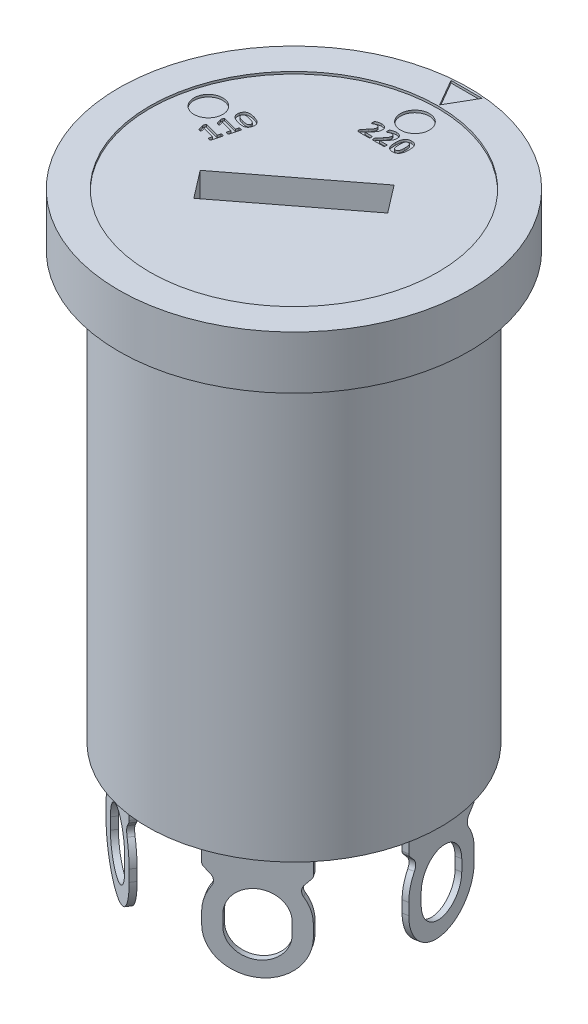
from build123d import *

# Parameters (mm, degrees)
SKETCH1_R                = 7.6
BOSS_EXTRUDE1_DEPTH      = 1.15
SKETCH2_R                = 6.35
BOSS_EXTRUDE2_DEPTH      = 18.5
BOSS_EXTRUDE3_DEPTH      = 5
CUT_EXTRUDE1_REACH       = 31.171
FILLET1_R                = 0.2
CIRPATTERN1_COUNT        = 4
CIRPATTERN1_ANGLE        = 200
FILLET1_OF_CIRPATTERN1_R = 0.2
SKETCH5_R                = 6.25
CUT_EXTRUDE2_DEPTH       = 0.1
CUT_EXTRUDE3_DEPTH       = 3
SKETCH7_R                = 0.625
CUT_EXTRUDE4_DEPTH       = 0.1


with BuildPart() as part:
    # Sketch1 → Boss-Extrude1 (new, symmetric)
    with BuildSketch(Plane(origin=(0, 0, 0), x_dir=(1, 0, 0), z_dir=(0, 1, 0))):
        with Locations(Location((0, 0, 0), (0, 0, 270))):
            Circle(SKETCH1_R)
    extrude(amount=BOSS_EXTRUDE1_DEPTH, both=True)

    # Sketch2 → Boss-Extrude2 (add)
    with BuildSketch(Plane.XZ.offset(1.15)):
        with Locations(Location((0, 0, 0), (0, 0, 270))):
            Circle(SKETCH2_R)
    extrude(amount=BOSS_EXTRUDE2_DEPTH)

    # Sketch3 → Boss-Extrude3 (add)
    with BuildSketch(Plane.XZ.offset(19.65)):
        Polygon((-5.137178524, -2.682819749), (-4.890976586, -2.639407705), (-5.498745208, 0.807419431), (-5.744947146, 0.764007386), align=None)
    boss_extrude3 = extrude(amount=BOSS_EXTRUDE3_DEPTH)

    # Sketch4 → Cut-Extrude1 (cut, up to next)
    with BuildSketch(Plane(origin=(-5.441062835, 0, -0.959406182), x_dir=(-0.1736481776669273, 0, 0.9848077530122086), z_dir=(-0.9848077530122086, 0, -0.1736481776669273)), mode=Mode.PRIVATE) as cut_extrude1_sk1:
        with BuildLine():
            Line((-1.084702388, -22.4), (-1.084702388, -22.9))
            ThreePointArc((-1.084702388, -22.9), (0, -23.984702388), (1.084702388, -22.9))
            Line((1.084702388, -22.9), (1.084702388, -22.4))
            ThreePointArc((1.084702388, -22.4), (0, -21.315297612), (-1.084702388, -22.4))
        make_face()
    cut_extrude1_tool1 = extrude(cut_extrude1_sk1.sketch, amount=-CUT_EXTRUDE1_REACH, mode=Mode.PRIVATE) & part.part
    # Sketch4 → Cut-Extrude1 (cut, up to next)
    with BuildSketch(Plane(origin=(-5.441062835, 0, -0.959406182), x_dir=(-0.1736481776669273, 0, 0.9848077530122086), z_dir=(-0.9848077530122086, 0, -0.1736481776669273)), mode=Mode.PRIVATE) as cut_extrude1_sk2:
        with BuildLine():
            Line((1.75, -20.65), (1.474258984, -20.960255312))
            ThreePointArc((1.474258984, -20.960255312), (1.381845573, -21.181807831), (1.445322291, -21.413316933))
            ThreePointArc((1.445322291, -21.413316933), (1.672096589, -21.883673557), (1.75, -22.4))
            Line((1.75, -22.4), (1.75, -20.65))
        make_face()
    cut_extrude1_tool2 = extrude(cut_extrude1_sk2.sketch, amount=-CUT_EXTRUDE1_REACH, mode=Mode.PRIVATE) & part.part
    # Sketch4 → Cut-Extrude1 (cut, up to next)
    with BuildSketch(Plane(origin=(-5.441062835, 0, -0.959406182), x_dir=(-0.1736481776669273, 0, 0.9848077530122086), z_dir=(-0.9848077530122086, 0, -0.1736481776669273)), mode=Mode.PRIVATE) as cut_extrude1_sk3:
        with BuildLine():
            Line((-1.75, -20.65), (-1.75, -22.4))
            ThreePointArc((-1.75, -22.4), (-1.672096589, -21.883673557), (-1.445322291, -21.413316933))
            ThreePointArc((-1.445322291, -21.413316933), (-1.381845573, -21.181807831), (-1.474258984, -20.960255312))
            Line((-1.474258984, -20.960255312), (-1.75, -20.65))
        make_face()
    cut_extrude1_tool3 = extrude(cut_extrude1_sk3.sketch, amount=-CUT_EXTRUDE1_REACH, mode=Mode.PRIVATE) & part.part
    # Sketch4 → Cut-Extrude1 (cut, up to next)
    with BuildSketch(Plane(origin=(-5.441062835, 0, -0.959406182), x_dir=(-0.1736481776669273, 0, 0.9848077530122086), z_dir=(-0.9848077530122086, 0, -0.1736481776669273)), mode=Mode.PRIVATE) as cut_extrude1_sk4:
        with BuildLine():
            Line((-1.75, -24.65), (1e-09, -24.65))
            ThreePointArc((1e-09, -24.65), (-1.237436867, -24.137436867), (-1.75, -22.9))
            Line((-1.75, -22.9), (-1.75, -24.65))
        make_face()
    cut_extrude1_tool4 = extrude(cut_extrude1_sk4.sketch, amount=-CUT_EXTRUDE1_REACH, mode=Mode.PRIVATE) & part.part
    # Sketch4 → Cut-Extrude1 (cut, up to next)
    with BuildSketch(Plane(origin=(-5.441062835, 0, -0.959406182), x_dir=(-0.1736481776669273, 0, 0.9848077530122086), z_dir=(-0.9848077530122086, 0, -0.1736481776669273)), mode=Mode.PRIVATE) as cut_extrude1_sk5:
        with BuildLine():
            Line((1.75, -24.65), (1.75, -22.9))
            ThreePointArc((1.75, -22.9), (1.237436867, -24.137436867), (1e-09, -24.65))
            Line((1e-09, -24.65), (1.75, -24.65))
        make_face()
    cut_extrude1_tool5 = extrude(cut_extrude1_sk5.sketch, amount=-CUT_EXTRUDE1_REACH, mode=Mode.PRIVATE) & part.part
    cut_extrude1_1 = cut_extrude1_tool1.solids().sort_by_distance((-5.441063, -22.65, -0.959406))[0]
    add(cut_extrude1_1, mode=Mode.SUBTRACT)
    cut_extrude1_2 = cut_extrude1_tool2.solids().sort_by_distance((-5.721703, -21.293717, 0.632181))[0]
    add(cut_extrude1_2, mode=Mode.SUBTRACT)
    cut_extrude1_3 = cut_extrude1_tool3.solids().sort_by_distance((-5.160423, -21.293717, -2.550993))[0]
    add(cut_extrude1_3, mode=Mode.SUBTRACT)
    cut_extrude1_4 = cut_extrude1_tool4.solids().sort_by_distance((-5.205057, -24.259106, -2.297864))[0]
    add(cut_extrude1_4, mode=Mode.SUBTRACT)
    cut_extrude1_5 = cut_extrude1_tool5.solids().sort_by_distance((-5.677069, -24.259106, 0.379052))[0]
    add(cut_extrude1_5, mode=Mode.SUBTRACT)
    cut_extrude1 = cut_extrude1_1 + cut_extrude1_2 + cut_extrude1_3 + cut_extrude1_4 + cut_extrude1_5  # Cut-Extrude1 as one shape, for the pattern or mirror that repeats it

    # Fillet1
    fillet1_edges = [part.edges().sort_by_distance(p)[0] for p in [
        (-5.014077555, -20.65, -2.661113727),
        (-5.621846177, -20.65, 0.785713408),
    ]]
    fillet(fillet1_edges, radius=FILLET1_R)

    # CirPattern1: Boss-Extrude3, Cut-Extrude1 ×4 about axis
    cirpattern1_axis = Axis((0, 0, 0), (0, 1, 0))
    add([boss_extrude3.rotate(cirpattern1_axis, i * CIRPATTERN1_ANGLE / (CIRPATTERN1_COUNT - 1)) for i in range(1, CIRPATTERN1_COUNT)])
    add([cut_extrude1.rotate(cirpattern1_axis, i * CIRPATTERN1_ANGLE / (CIRPATTERN1_COUNT - 1)) for i in range(1, CIRPATTERN1_COUNT)], mode=Mode.SUBTRACT)

    # Fillet1 of CirPattern1
    fillet1_of_cirpattern1_edges = [part.edges().sort_by_distance(p)[0] for p in [
        (-4.429452152, -20.65, 3.54999347),
        (-1.505244812, -20.65, 5.473274893),
        (1.505244812, -20.65, 5.473274893),
        (4.429452152, -20.65, 3.54999347),
        (5.621846177, -20.65, 0.785713408),
        (5.014077555, -20.65, -2.661113727),
    ]]
    fillet(fillet1_of_cirpattern1_edges, radius=FILLET1_OF_CIRPATTERN1_R)

    # Sketch5 → Cut-Extrude2 (cut)
    with BuildSketch(Plane(origin=(0, 1.15, 0), x_dir=(1, 0, 0), z_dir=(0, 1, 0))):
        with Locations(Location((0, 0, 0), (0, 0, 270))):
            Circle(SKETCH5_R)
        Polygon((0, 6.320577137), (0.675, 7.489711432), (-0.675, 7.489711432), align=None)
    extrude(amount=-CUT_EXTRUDE2_DEPTH, mode=Mode.SUBTRACT)

    # Sketch6 → Cut-Extrude3 (cut)
    with BuildSketch(Plane(origin=(0, 1.05, 0), x_dir=(1, 0, 0), z_dir=(0, 1, 0))):
        Polygon((-2.836631093, -1.231269282), (1.923488949, 2.421299292), (2.836631093, 1.231269282), (-1.923488949, -2.421299292), align=None)
    extrude(amount=-CUT_EXTRUDE3_DEPTH, mode=Mode.SUBTRACT)

    # Sketch7 → Cut-Extrude4 (cut)
    # profile 1 of 8: a face of its own
    with BuildSketch(Plane(origin=(0, 1.05, 0), x_dir=(1, 0, 0), z_dir=(0, 1, 0))):
        with Locations(Location((0, 5.25, 0), (0, 0, 270))):
            Circle(SKETCH7_R)
    # profile 2 of 8: a face of its own
    with BuildSketch(Plane(origin=(0, 1.05, 0), x_dir=(1, 0, 0), z_dir=(0, 1, 0))):
        with Locations(Location((-5.071110588, 1.358799987, 0), (0, 0, 270))):
            Circle(SKETCH7_R)
    # profile 3 of 8: a face of its own
    with BuildSketch(Plane(origin=(0, 1.05, 0), x_dir=(1, 0, 0), z_dir=(0, 1, 0))):
        with BuildLine():
            add(Edge.make_bspline(
                [(-3.673085561, 1.940530135), (-3.658145348, 1.936361866), (-3.62903577, 1.928240392), (-3.587140018, 1.913867484), (-3.547928097, 1.89851542), (-3.511575049, 1.881700826), (-3.478072823, 1.863870231), (-3.447977591, 1.844082858), (-3.421184433, 1.822698939), (-3.397658418, 1.799740336), (-3.377767174, 1.774961081), (-3.36157215, 1.748492487), (-3.348974447, 1.720329943), (-3.34042885, 1.690303427), (-3.335541318, 1.658374888), (-3.335406929, 1.624403585), (-3.339403169, 1.588393369), (-3.345353228, 1.564209779), (-3.348435974, 1.551680181)],
                knots=[0, 0, 0, 0, 1.288888502, 2.511276299, 3.67946271, 4.787240792, 5.83855392, 6.830771249, 7.776144556, 8.683694379, 9.557256889, 10.409980498, 11.255985797, 12.113159026, 12.99712284, 13.93195878, 14.92854091, 16, 16, 16, 16], degree=3))
            add(Edge.make_bspline(
                [(-3.348435974, 1.551680181), (-3.352064065, 1.539188901), (-3.359036652, 1.515182742), (-3.373299262, 1.481967022), (-3.390115576, 1.453021031), (-3.409383257, 1.428206666), (-3.431253127, 1.407500672), (-3.455339805, 1.390398241), (-3.481682399, 1.376783431), (-3.510246865, 1.366742302), (-3.540959073, 1.360109383), (-3.573819393, 1.356338579), (-3.608856279, 1.355442546), (-3.646016296, 1.357890469), (-3.685217038, 1.362659999), (-3.726422704, 1.369959365), (-3.769716625, 1.378974096), (-3.799022984, 1.386556399), (-3.814071027, 1.390449712)],
                knots=[0, 0, 0, 0, 1.10265549, 2.119120177, 3.057597963, 3.93557148, 4.77461656, 5.603166586, 6.433560418, 7.281780143, 8.163939511, 9.09343249, 10.083975126, 11.132740266, 12.249644105, 13.432427502, 14.68161916, 16, 16, 16, 16], degree=3))
            add(Edge.make_bspline(
                [(-3.814071027, 1.390449712), (-3.828888353, 1.394622667), (-3.857809707, 1.402767694), (-3.899525369, 1.417131822), (-3.938709652, 1.432530519), (-3.975319199, 1.449204161), (-4.008850075, 1.467515988), (-4.039112318, 1.487389119), (-4.065972279, 1.50882869), (-4.089498367, 1.53178647), (-4.109388554, 1.556566148), (-4.125587596, 1.583033856), (-4.138170368, 1.611199513), (-4.146770474, 1.641205652), (-4.151434556, 1.673170986), (-4.151298891, 1.706990564), (-4.147588964, 1.742820952), (-4.141752087, 1.766830127), (-4.138720613, 1.779299666)],
                knots=[0, 0, 0, 0, 1.280067043, 2.49851228, 3.667504, 4.780637386, 5.841954191, 6.841860431, 7.787885448, 8.696060907, 9.570225623, 10.423537073, 11.270125581, 12.127889718, 13.011725577, 13.947164967, 14.933828194, 16, 16, 16, 16], degree=3))
            add(Edge.make_bspline(
                [(-4.138720613, 1.779299666), (-4.13502552, 1.791791386), (-4.127928963, 1.815782177), (-4.113586713, 1.848983418), (-4.097132268, 1.878172674), (-4.077702101, 1.902951358), (-4.05591877, 1.923841367), (-4.031899459, 1.941084859), (-4.005618574, 1.95479833), (-3.977007787, 1.964740999), (-3.946295273, 1.971691424), (-3.913321809, 1.975154226), (-3.878295692, 1.975898339), (-3.841129703, 1.973292872), (-3.801977935, 1.968194002), (-3.76068497, 1.961341733), (-3.71746959, 1.951922273), (-3.688139492, 1.944394058), (-3.673085561, 1.940530135)],
                knots=[0, 0, 0, 0, 1.103382044, 2.119084338, 3.058725513, 3.936040511, 4.778012346, 5.608934786, 6.434132243, 7.281715765, 8.169368317, 9.09757777, 10.087256706, 11.135551956, 12.252248491, 13.433279306, 14.682608003, 16, 16, 16, 16], degree=3))
        make_face()
        with BuildLine():
            add(Edge.make_bspline(
                [(-3.707556781, 1.78112354), (-3.716367172, 1.783452413), (-3.733474209, 1.787974358), (-3.758434878, 1.794244062), (-3.781995581, 1.799464632), (-3.804033525, 1.804154135), (-3.824754464, 1.807659378), (-3.844091356, 1.811028027), (-3.862329119, 1.812836745), (-3.88411902, 1.814850337), (-3.908651563, 1.815597112), (-3.93490456, 1.813527346), (-3.957384849, 1.80896228), (-3.975917459, 1.800584592), (-3.991020091, 1.789392987), (-4.002808988, 1.775296999), (-4.011409801, 1.758422332), (-4.015133903, 1.746114382), (-4.017068212, 1.739721599)],
                knots=[0, 0, 0, 0, 1.253449212, 2.433807992, 3.539439553, 4.57262314, 5.532225414, 6.429933913, 7.271186828, 8.051733231, 9.440243207, 10.640225063, 11.668762209, 12.578117937, 13.414326999, 14.233385131, 15.082415333, 16, 16, 16, 16], degree=3))
            add(Edge.make_bspline(
                [(-4.017068212, 1.739721599), (-4.018404092, 1.734095858), (-4.020980447, 1.723246157), (-4.021794628, 1.706995335), (-4.02053717, 1.691597989), (-4.01616237, 1.677188935), (-4.009462827, 1.663554763), (-4.000128582, 1.650827817), (-3.988765504, 1.638419455), (-3.974672369, 1.627020605), (-3.95833926, 1.615993361), (-3.939509689, 1.60582433), (-3.91856731, 1.595654744), (-3.895205433, 1.58607251), (-3.869440215, 1.576908954), (-3.841562776, 1.567554024), (-3.811421877, 1.558493147), (-3.790553585, 1.552676331), (-3.779782194, 1.549673919)],
                knots=[0, 0, 0, 0, 0.815250163, 1.572276623, 2.288444131, 2.986881971, 3.685953218, 4.424782941, 5.208806639, 6.056657412, 6.978535701, 7.989600004, 9.076709549, 10.266580688, 11.554373423, 12.939529382, 14.420305599, 16, 16, 16, 16], degree=3))
            add(Edge.make_bspline(
                [(-3.779782194, 1.549673919), (-3.76672587, 1.546271163), (-3.741710461, 1.539751613), (-3.705720592, 1.531361061), (-3.673013368, 1.524691885), (-3.643500995, 1.519900578), (-3.616853915, 1.516680765), (-3.592858574, 1.515157952), (-3.571331615, 1.515236159), (-3.552268604, 1.516977086), (-3.535370946, 1.520332502), (-3.520712698, 1.525633862), (-3.508007074, 1.532392328), (-3.497348135, 1.5409295), (-3.488703373, 1.551338063), (-3.481183987, 1.562989109), (-3.475135098, 1.576289164), (-3.472285577, 1.585808257), (-3.470817925, 1.590711086)],
                knots=[0, 0, 0, 0, 1.858093567, 3.56003503, 5.088754229, 6.45421991, 7.676573755, 8.783795317, 9.763434588, 10.638209312, 11.416553333, 12.129018664, 12.777185194, 13.390451812, 13.996184933, 14.63256365, 15.295698887, 16, 16, 16, 16], degree=3))
            add(Edge.make_bspline(
                [(-3.470817925, 1.590711086), (-3.469146185, 1.598087799), (-3.465950071, 1.612190956), (-3.466632992, 1.633375654), (-3.471359248, 1.653117435), (-3.480915769, 1.671340846), (-3.494507099, 1.688446326), (-3.512865608, 1.703844069), (-3.535163931, 1.718429886), (-3.561614711, 1.732107031), (-3.591993849, 1.745545098), (-3.626821097, 1.757671262), (-3.665736918, 1.769681903), (-3.69318551, 1.777191656), (-3.707556781, 1.78112354)],
                knots=[0, 0, 0, 0, 0.799174179, 1.527900087, 2.225239573, 2.934486112, 3.691601609, 4.527901275, 5.463018283, 6.512691251, 7.681737495, 8.982679637, 10.420220384, 12, 12, 12, 12], degree=3))
        make_face(mode=Mode.SUBTRACT)
    # profile 4 of 8: a face of its own
    with BuildSketch(Plane(origin=(0, 1.05, 0), x_dir=(1, 0, 0), z_dir=(0, 1, 0))):
        with BuildLine():
            add(Edge.make_bspline(
                [(-3.518064113, 1.210057821), (-3.512925018, 1.208631321), (-3.503517025, 1.20601987), (-3.491040011, 1.201143143), (-3.48094146, 1.196680225), (-3.473694748, 1.191413636), (-3.468438595, 1.186353541), (-3.465608599, 1.181017296), (-3.464251117, 1.175682974), (-3.464859542, 1.172244345), (-3.465171765, 1.170479754)],
                knots=[0, 0, 0, 0, 1.771150707, 3.242394248, 4.453591281, 5.423837813, 6.20991664, 6.851853358, 7.41080901, 8, 8, 8, 8], degree=3))
            Line((-3.465171765, 1.170479754), (-3.578434345, 0.747340967))
            add(Edge.make_bspline(
                [(-3.578434345, 0.747340967), (-3.579018029, 0.745836899), (-3.580227818, 0.742719446), (-3.583872723, 0.738708316), (-3.589351047, 0.736093794), (-3.596213872, 0.733986602), (-3.605129673, 0.733481009), (-3.61608362, 0.73403912), (-3.62929967, 0.73642766), (-3.63875903, 0.738769759), (-3.643911425, 0.740045471)],
                knots=[0, 0, 0, 0, 0.537906039, 1.114907901, 1.762103588, 2.548575406, 3.509645445, 4.733651234, 6.220860693, 8, 8, 8, 8], degree=3))
            add(Edge.make_bspline(
                [(-3.643911425, 0.740045471), (-3.649153171, 0.741511848), (-3.658745305, 0.744195245), (-3.671662623, 0.748594198), (-3.681712504, 0.753502), (-3.689697168, 0.758138957), (-3.694730409, 0.763683431), (-3.698595548, 0.768685349), (-3.699675236, 0.774331278), (-3.699096928, 0.777868669), (-3.698810035, 0.779623538)],
                knots=[0, 0, 0, 0, 1.767848226, 3.235073704, 4.418112217, 5.403692162, 6.199406899, 6.839944907, 7.42450682, 8, 8, 8, 8], degree=3))
            Line((-3.698810035, 0.779623538), (-3.660691067, 0.922432879))
            Line((-3.660691067, 0.922432879), (-4.159703015, 1.056122849))
            Line((-4.159703015, 1.056122849), (-4.124684633, 0.91459022))
            add(Edge.make_bspline(
                [(-4.124684633, 0.91459022), (-4.123885088, 0.909980743), (-4.122481657, 0.901889783), (-4.122224105, 0.891042203), (-4.124030064, 0.882450065), (-4.12987786, 0.876672398), (-4.138804446, 0.87465652), (-4.147731034, 0.875002977), (-4.156486324, 0.876564718), (-4.164741669, 0.877907612), (-4.174196567, 0.880209159), (-4.180923255, 0.881935106), (-4.184507703, 0.882854811)],
                knots=[0, 0, 0, 0, 1.4683962, 2.577457833, 3.412708581, 4.142849099, 5.020160429, 6.205863269, 6.941491768, 7.815462538, 8.835926519, 10, 10, 10, 10], degree=3))
            add(Edge.make_bspline(
                [(-4.184507703, 0.882854811), (-4.18883067, 0.884047791), (-4.196656791, 0.886207513), (-4.207236696, 0.889458446), (-4.215766403, 0.892704441), (-4.222580322, 0.896532534), (-4.22772993, 0.901184566), (-4.231854164, 0.906409783), (-4.234982924, 0.912791337), (-4.236662563, 0.917489069), (-4.237582438, 0.920061842)],
                knots=[0, 0, 0, 0, 1.563236685, 2.830018684, 3.85715216, 4.740405492, 5.535906752, 6.260807096, 7.047508607, 8, 8, 8, 8], degree=3))
            Line((-4.237582438, 0.920061842), (-4.300141319, 1.113392495))
            add(Edge.make_bspline(
                [(-4.300141319, 1.113392495), (-4.300525058, 1.114723404), (-4.301318242, 1.117474375), (-4.302218682, 1.12211569), (-4.301714849, 1.127691112), (-4.301329011, 1.134654347), (-4.299711782, 1.143237377), (-4.297182083, 1.153960499), (-4.293899044, 1.167493177), (-4.291117796, 1.177480659), (-4.28956285, 1.183064485)],
                knots=[0, 0, 0, 0, 0.46664555, 0.964550346, 1.578804146, 2.338448065, 3.314078128, 4.510464578, 6.049061819, 8, 8, 8, 8], degree=3))
            add(Edge.make_bspline(
                [(-4.28956285, 1.183064485), (-4.287732094, 1.189890265), (-4.284481316, 1.202010443), (-4.279457779, 1.217990032), (-4.275228389, 1.2301249), (-4.27103755, 1.238691652), (-4.267121153, 1.244609833), (-4.26240908, 1.247541673), (-4.257499715, 1.248280931), (-4.254353042, 1.247611924), (-4.252720593, 1.247264853)],
                knots=[0, 0, 0, 0, 2.098582548, 3.72634283, 4.977594343, 5.90632889, 6.563663806, 7.049900541, 7.507102178, 8, 8, 8, 8], degree=3))
            Line((-4.252720593, 1.247264853), (-3.619106737, 1.077644563))
            Line((-3.619106737, 1.077644563), (-3.585547454, 1.202762325))
            add(Edge.make_bspline(
                [(-3.585547454, 1.202762325), (-3.584936083, 1.204474233), (-3.583724651, 1.207866381), (-3.579587837, 1.211938343), (-3.574030523, 1.215058199), (-3.566608782, 1.216705672), (-3.557517097, 1.217490526), (-3.546376016, 1.216280176), (-3.532983569, 1.213865225), (-3.523338825, 1.211403913), (-3.518064113, 1.210057821)],
                knots=[0, 0, 0, 0, 0.581756919, 1.152752086, 1.831682654, 2.624413837, 3.592408048, 4.777872241, 6.237818275, 8, 8, 8, 8], degree=3))
        make_face()
    # profile 5 of 8: a face of its own
    with BuildSketch(Plane(origin=(0, 1.05, 0), x_dir=(1, 0, 0), z_dir=(0, 1, 0))):
        with BuildLine():
            add(Edge.make_bspline(
                [(-3.684226892, 0.58992989), (-3.679087797, 0.58850339), (-3.669679804, 0.585891938), (-3.65720279, 0.581015211), (-3.647104238, 0.576552293), (-3.639857526, 0.571285704), (-3.634601374, 0.56622561), (-3.631771378, 0.560889365), (-3.630413896, 0.555555042), (-3.63102232, 0.552116413), (-3.631334544, 0.550351822)],
                knots=[0, 0, 0, 0, 1.771150707, 3.242394248, 4.453591281, 5.423837813, 6.20991664, 6.851853358, 7.41080901, 8, 8, 8, 8], degree=3))
            Line((-3.631334544, 0.550351822), (-3.744597124, 0.127213035))
            add(Edge.make_bspline(
                [(-3.744597124, 0.127213035), (-3.745180807, 0.125708968), (-3.746390596, 0.122591514), (-3.750035502, 0.118580384), (-3.755513825, 0.115965863), (-3.762376651, 0.11385867), (-3.771292452, 0.113353077), (-3.782246399, 0.113911188), (-3.795462448, 0.116299729), (-3.804921808, 0.118641827), (-3.810074203, 0.119917539)],
                knots=[0, 0, 0, 0, 0.537906039, 1.114907901, 1.762103588, 2.548575406, 3.509645445, 4.733651234, 6.220860693, 8, 8, 8, 8], degree=3))
            add(Edge.make_bspline(
                [(-3.810074203, 0.119917539), (-3.81531595, 0.121383916), (-3.824908083, 0.124067313), (-3.837825401, 0.128466266), (-3.847875283, 0.133374069), (-3.855859947, 0.138011025), (-3.860893187, 0.143555499), (-3.864758326, 0.148557417), (-3.865838014, 0.154203346), (-3.865259707, 0.157740738), (-3.864972813, 0.159495607)],
                knots=[0, 0, 0, 0, 1.767848226, 3.235073704, 4.418112217, 5.403692162, 6.199406899, 6.839944907, 7.42450682, 8, 8, 8, 8], degree=3))
            Line((-3.864972813, 0.159495607), (-3.826853845, 0.302304947))
            Line((-3.826853845, 0.302304947), (-4.325865794, 0.435994917))
            Line((-4.325865794, 0.435994917), (-4.290847411, 0.294462289))
            add(Edge.make_bspline(
                [(-4.290847411, 0.294462289), (-4.290047866, 0.289852811), (-4.288644435, 0.281761852), (-4.288386883, 0.270914271), (-4.290192843, 0.262322133), (-4.296040639, 0.256544466), (-4.304967225, 0.254528589), (-4.313893812, 0.254875045), (-4.322649103, 0.256436786), (-4.330904447, 0.25777968), (-4.340359345, 0.260081227), (-4.347086034, 0.261807175), (-4.350670481, 0.26272688)],
                knots=[0, 0, 0, 0, 1.4683962, 2.577457833, 3.412708581, 4.142849099, 5.020160429, 6.205863269, 6.941491768, 7.815462538, 8.835926519, 10, 10, 10, 10], degree=3))
            add(Edge.make_bspline(
                [(-4.350670481, 0.26272688), (-4.354993449, 0.26391986), (-4.36281957, 0.266079581), (-4.373399475, 0.269330515), (-4.381929181, 0.272576509), (-4.3887431, 0.276404602), (-4.393892709, 0.281056635), (-4.398016942, 0.286281852), (-4.401145702, 0.292663406), (-4.402825341, 0.297361137), (-4.403745217, 0.299933911)],
                knots=[0, 0, 0, 0, 1.563236685, 2.830018684, 3.85715216, 4.740405492, 5.535906752, 6.260807096, 7.047508607, 8, 8, 8, 8], degree=3))
            Line((-4.403745217, 0.299933911), (-4.466304098, 0.493264563))
            add(Edge.make_bspline(
                [(-4.466304098, 0.493264563), (-4.466687837, 0.494595472), (-4.467481021, 0.497346443), (-4.468381461, 0.501987758), (-4.467877628, 0.50756318), (-4.467491789, 0.514526415), (-4.465874561, 0.523109446), (-4.463344861, 0.533832568), (-4.460061822, 0.547365245), (-4.457280575, 0.557352727), (-4.455725628, 0.562936553)],
                knots=[0, 0, 0, 0, 0.46664555, 0.964550346, 1.578804146, 2.338448065, 3.314078128, 4.510464578, 6.049061819, 8, 8, 8, 8], degree=3))
            add(Edge.make_bspline(
                [(-4.455725628, 0.562936553), (-4.453894872, 0.569762333), (-4.450644095, 0.581882511), (-4.445620558, 0.597862101), (-4.441391167, 0.609996968), (-4.437200328, 0.618563721), (-4.433283932, 0.624481902), (-4.428571859, 0.627413741), (-4.423662494, 0.628153), (-4.42051582, 0.627483992), (-4.418883372, 0.627136921)],
                knots=[0, 0, 0, 0, 2.098582548, 3.72634283, 4.977594343, 5.90632889, 6.563663806, 7.049900541, 7.507102178, 8, 8, 8, 8], degree=3))
            Line((-4.418883372, 0.627136921), (-3.785269516, 0.457516631))
            Line((-3.785269516, 0.457516631), (-3.751710233, 0.582634393))
            add(Edge.make_bspline(
                [(-3.751710233, 0.582634393), (-3.751098862, 0.584346302), (-3.74988743, 0.58773845), (-3.745750616, 0.591810411), (-3.740193301, 0.594930267), (-3.73277156, 0.596577741), (-3.723679876, 0.597362594), (-3.712538794, 0.596152245), (-3.699146348, 0.593737293), (-3.689501603, 0.591275981), (-3.684226892, 0.58992989)],
                knots=[0, 0, 0, 0, 0.581756919, 1.152752086, 1.831682654, 2.624413837, 3.592408048, 4.777872241, 6.237818275, 8, 8, 8, 8], degree=3))
        make_face()
    # profile 6 of 8: a face of its own
    with BuildSketch(Plane(origin=(0, 1.05, 0), x_dir=(1, 0, 0), z_dir=(0, 1, 0))):
        with BuildLine():
            add(Edge.make_bspline(
                [(-0.367693015, 3.714565142), (-0.367720313, 3.709148665), (-0.36777071, 3.699149058), (-0.369172904, 3.685408241), (-0.370730441, 3.673966595), (-0.373508673, 3.664910665), (-0.376745599, 3.657760608), (-0.381572878, 3.653076958), (-0.387179952, 3.650600006), (-0.391077588, 3.650201261), (-0.393044864, 3.65)],
                knots=[0, 0, 0, 0, 1.700477232, 3.139328327, 4.338937117, 5.31779253, 6.112293145, 6.774269824, 7.381330181, 8, 8, 8, 8], degree=3))
            Line((-0.393044864, 3.65), (-0.853208295, 3.65))
            add(Edge.make_bspline(
                [(-0.853208295, 3.65), (-0.857468038, 3.650088655), (-0.865425958, 3.650254278), (-0.87654221, 3.651865076), (-0.885959822, 3.655508519), (-0.893615037, 3.661692731), (-0.898971277, 3.670929361), (-0.90251394, 3.683080677), (-0.90425773, 3.69864812), (-0.904504773, 3.710184477), (-0.904641544, 3.716571404)],
                knots=[0, 0, 0, 0, 1.025949817, 1.916647791, 2.69162005, 3.43032923, 4.23901448, 5.220859075, 6.461371377, 8, 8, 8, 8], degree=3))
            add(Edge.make_bspline(
                [(-0.904641544, 3.716571404), (-0.90451322, 3.722773716), (-0.904276392, 3.734220455), (-0.903171496, 3.750228441), (-0.900668367, 3.764035213), (-0.896573656, 3.776342211), (-0.890674605, 3.787469145), (-0.88380878, 3.79866123), (-0.874721253, 3.809899218), (-0.867843319, 3.817411756), (-0.86415154, 3.821444164)],
                knots=[0, 0, 0, 0, 1.279770231, 2.361892714, 3.306414937, 4.167028953, 5.025172171, 5.898575693, 6.872045744, 8, 8, 8, 8], degree=3))
            Line((-0.86415154, 3.821444164), (-0.72900247, 3.96662454))
            add(Edge.make_bspline(
                [(-0.72900247, 3.96662454), (-0.722580217, 3.973642133), (-0.710161004, 3.987212599), (-0.692818508, 4.007412717), (-0.677498174, 4.026709373), (-0.664105263, 4.045060988), (-0.652311406, 4.062528719), (-0.642023722, 4.079170173), (-0.632919408, 4.094997347), (-0.623012628, 4.114563674), (-0.613438118, 4.137583161), (-0.605930475, 4.164001522), (-0.601996773, 4.188526861), (-0.601424584, 4.204324234), (-0.601148897, 4.211935604)],
                knots=[0, 0, 0, 0, 1.20947157, 2.338849612, 3.384319872, 4.341377303, 5.226828348, 6.063423144, 6.828539773, 7.547598628, 8.851019864, 9.991402106, 11.032232556, 12, 12, 12, 12], degree=3))
            add(Edge.make_bspline(
                [(-0.601148897, 4.211935604), (-0.601471974, 4.218046495), (-0.60211198, 4.230151996), (-0.606974784, 4.247562721), (-0.614810107, 4.263585418), (-0.626178312, 4.277376326), (-0.640480073, 4.289044416), (-0.658245494, 4.297355324), (-0.679137946, 4.302808839), (-0.694188461, 4.303375272), (-0.702191521, 4.303676471)],
                knots=[0, 0, 0, 0, 0.952592796, 1.887059298, 2.799298945, 3.716508085, 4.654435942, 5.655858967, 6.753510967, 8, 8, 8, 8], degree=3))
            add(Edge.make_bspline(
                [(-0.702191521, 4.303676471), (-0.708031206, 4.303573399), (-0.719370218, 4.303373263), (-0.73591358, 4.301767117), (-0.751378967, 4.298812715), (-0.770213941, 4.293792789), (-0.791398684, 4.285950652), (-0.813937165, 4.275398677), (-0.832986223, 4.264743982), (-0.846716515, 4.25646049), (-0.855853747, 4.250442991), (-0.861813498, 4.247808007), (-0.86686657, 4.245677222), (-0.870154523, 4.245425442), (-0.871629423, 4.2453125)],
                knots=[0, 0, 0, 0, 1.155956231, 2.244538859, 3.28550842, 4.269318886, 6.100628768, 7.748195433, 9.191883973, 10.417953324, 10.925724687, 11.351067817, 11.708904068, 12, 12, 12, 12], degree=3))
            add(Edge.make_bspline(
                [(-0.871629423, 4.2453125), (-0.873378938, 4.245468987), (-0.876902662, 4.245784169), (-0.881622821, 4.249161787), (-0.885315283, 4.254610275), (-0.887915209, 4.262550799), (-0.889963408, 4.273087286), (-0.891797997, 4.286602082), (-0.892796436, 4.303297052), (-0.892908002, 4.3154696), (-0.89296875, 4.322097599)],
                knots=[0, 0, 0, 0, 0.485692822, 0.97824142, 1.565816375, 2.311318477, 3.305989244, 4.581102635, 6.138397226, 8, 8, 8, 8], degree=3))
            add(Edge.make_bspline(
                [(-0.89296875, 4.322097599), (-0.89296622, 4.326598498), (-0.892961635, 4.334756543), (-0.892161193, 4.346010271), (-0.891171956, 4.35541287), (-0.889531288, 4.363421608), (-0.887332115, 4.370271028), (-0.884451692, 4.37664223), (-0.879828864, 4.382995018), (-0.874598169, 4.388734116), (-0.868522516, 4.393823878), (-0.862156325, 4.398291291), (-0.85422119, 4.403294471), (-0.840706404, 4.410533686), (-0.820718106, 4.42025533), (-0.792934879, 4.430764594), (-0.761346603, 4.440494345), (-0.726630687, 4.448741199), (-0.689484969, 4.454440085), (-0.663911457, 4.455092096), (-0.650940659, 4.455422794)],
                knots=[0, 0, 0, 0, 0.788292368, 1.428808632, 1.975788089, 2.443732868, 2.858052408, 3.234493626, 3.66294862, 4.228288178, 4.591069522, 5.049213324, 5.590039132, 6.233559628, 7.734267659, 9.480939635, 11.431700141, 13.521863135, 15.728704436, 18, 18, 18, 18], degree=3))
            add(Edge.make_bspline(
                [(-0.650940659, 4.455422794), (-0.640840598, 4.455275256), (-0.621263943, 4.454989288), (-0.592848155, 4.452001203), (-0.566391079, 4.447228485), (-0.54196441, 4.440187078), (-0.519508462, 4.431648818), (-0.498902697, 4.421656519), (-0.480393856, 4.409932059), (-0.463836353, 4.396699641), (-0.449251295, 4.382160874), (-0.436594659, 4.366210516), (-0.426094867, 4.348893518), (-0.417446248, 4.330367486), (-0.410958659, 4.310806509), (-0.406248656, 4.290536501), (-0.403156945, 4.269543037), (-0.402861589, 4.255294083), (-0.402711397, 4.248048311)],
                knots=[0, 0, 0, 0, 1.324900052, 2.568015312, 3.744666331, 4.8481595, 5.898614886, 6.894039723, 7.847934722, 8.767415271, 9.669989851, 10.544631889, 11.43259769, 12.321315746, 13.221949113, 14.131442766, 15.049815173, 16, 16, 16, 16], degree=3))
            add(Edge.make_bspline(
                [(-0.402711397, 4.248048311), (-0.40306839, 4.235202567), (-0.403780544, 4.20957703), (-0.408438679, 4.177655116), (-0.414319969, 4.152033828), (-0.421141295, 4.132250616), (-0.429433564, 4.111558356), (-0.440207646, 4.090224044), (-0.452875849, 4.067794182), (-0.467869354, 4.04430813), (-0.485247745, 4.019687714), (-0.505147634, 3.993823107), (-0.527781892, 3.966223449), (-0.553695565, 3.936723387), (-0.583134161, 3.905216282), (-0.604086544, 3.883720001), (-0.61501034, 3.872512638)],
                knots=[0, 0, 0, 0, 1.214695824, 2.423155294, 3.043825433, 3.698462194, 4.400034292, 5.150962269, 5.956941602, 6.835925221, 7.785176393, 8.806499493, 9.921972916, 11.160753287, 12.51972206, 14, 14, 14, 14], degree=3))
            Line((-0.61501034, 3.872512638), (-0.706204044, 3.778400735))
            Line((-0.706204044, 3.778400735), (-0.395051126, 3.778400735))
            add(Edge.make_bspline(
                [(-0.395051126, 3.778400735), (-0.393067892, 3.778232552), (-0.389085417, 3.777894828), (-0.38356515, 3.774793893), (-0.378499283, 3.770178577), (-0.374541585, 3.763211376), (-0.37121184, 3.754320005), (-0.369303557, 3.743016541), (-0.367740709, 3.729565031), (-0.36770966, 3.719800258), (-0.367693015, 3.714565142)],
                knots=[0, 0, 0, 0, 0.620001289, 1.24500623, 1.94939785, 2.757032326, 3.738367869, 4.928457297, 6.353276405, 8, 8, 8, 8], degree=3))
        make_face()
    # profile 7 of 8: a face of its own
    with BuildSketch(Plane(origin=(0, 1.05, 0), x_dir=(1, 0, 0), z_dir=(0, 1, 0))):
        with BuildLine():
            add(Edge.make_bspline(
                [(0.274310662, 3.714565142), (0.274283363, 3.709148665), (0.274232967, 3.699149058), (0.272830773, 3.685408241), (0.271273235, 3.673966595), (0.268495003, 3.664910665), (0.265258077, 3.657760608), (0.260430798, 3.653076958), (0.254823724, 3.650600006), (0.250926088, 3.650201261), (0.248958812, 3.65)],
                knots=[0, 0, 0, 0, 1.700477232, 3.139328327, 4.338937117, 5.31779253, 6.112293145, 6.774269824, 7.381330181, 8, 8, 8, 8], degree=3))
            Line((0.248958812, 3.65), (-0.211204619, 3.65))
            add(Edge.make_bspline(
                [(-0.211204619, 3.65), (-0.215464361, 3.650088655), (-0.223422281, 3.650254278), (-0.234538533, 3.651865076), (-0.243956146, 3.655508519), (-0.251611361, 3.661692731), (-0.256967601, 3.670929361), (-0.260510263, 3.683080677), (-0.262254054, 3.69864812), (-0.262501096, 3.710184477), (-0.262637868, 3.716571404)],
                knots=[0, 0, 0, 0, 1.025949817, 1.916647791, 2.69162005, 3.43032923, 4.23901448, 5.220859075, 6.461371377, 8, 8, 8, 8], degree=3))
            add(Edge.make_bspline(
                [(-0.262637868, 3.716571404), (-0.262509544, 3.722773716), (-0.262272715, 3.734220455), (-0.261167819, 3.750228441), (-0.258664691, 3.764035213), (-0.25456998, 3.776342211), (-0.248670928, 3.787469145), (-0.241805103, 3.79866123), (-0.232717577, 3.809899218), (-0.225839642, 3.817411756), (-0.222147863, 3.821444164)],
                knots=[0, 0, 0, 0, 1.279770231, 2.361892714, 3.306414937, 4.167028953, 5.025172171, 5.898575693, 6.872045744, 8, 8, 8, 8], degree=3))
            Line((-0.222147863, 3.821444164), (-0.086998794, 3.96662454))
            add(Edge.make_bspline(
                [(-0.086998794, 3.96662454), (-0.08057654, 3.973642133), (-0.068157327, 3.987212599), (-0.050814831, 4.007412717), (-0.035494497, 4.026709373), (-0.022101586, 4.045060988), (-0.010307729, 4.062528719), (-2.0045e-05, 4.079170173), (0.009084268, 4.094997347), (0.018991048, 4.114563674), (0.028565558, 4.137583161), (0.036073202, 4.164001522), (0.040006904, 4.188526861), (0.040579092, 4.204324234), (0.040854779, 4.211935604)],
                knots=[0, 0, 0, 0, 1.20947157, 2.338849612, 3.384319872, 4.341377303, 5.226828348, 6.063423144, 6.828539773, 7.547598628, 8.851019864, 9.991402106, 11.032232556, 12, 12, 12, 12], degree=3))
            add(Edge.make_bspline(
                [(0.040854779, 4.211935604), (0.040531703, 4.218046495), (0.039891696, 4.230151996), (0.035028893, 4.247562721), (0.02719357, 4.263585418), (0.015825364, 4.277376326), (0.001523603, 4.289044416), (-0.016241817, 4.297355324), (-0.03713427, 4.302808839), (-0.052184784, 4.303375272), (-0.060187845, 4.303676471)],
                knots=[0, 0, 0, 0, 0.952592796, 1.887059298, 2.799298945, 3.716508085, 4.654435942, 5.655858967, 6.753510967, 8, 8, 8, 8], degree=3))
            add(Edge.make_bspline(
                [(-0.060187845, 4.303676471), (-0.06602753, 4.303573399), (-0.077366541, 4.303373263), (-0.093909903, 4.301767117), (-0.109375291, 4.298812715), (-0.128210265, 4.293792789), (-0.149395008, 4.285950652), (-0.171933488, 4.275398677), (-0.190982547, 4.264743982), (-0.204712839, 4.25646049), (-0.21385007, 4.250442991), (-0.219809822, 4.247808007), (-0.224862893, 4.245677222), (-0.228150847, 4.245425442), (-0.229625747, 4.2453125)],
                knots=[0, 0, 0, 0, 1.155956231, 2.244538859, 3.28550842, 4.269318886, 6.100628768, 7.748195433, 9.191883973, 10.417953324, 10.925724687, 11.351067817, 11.708904068, 12, 12, 12, 12], degree=3))
            add(Edge.make_bspline(
                [(-0.229625747, 4.2453125), (-0.231375261, 4.245468987), (-0.234898985, 4.245784169), (-0.239619145, 4.249161787), (-0.243311606, 4.254610275), (-0.245911533, 4.262550799), (-0.247959731, 4.273087286), (-0.24979432, 4.286602082), (-0.25079276, 4.303297052), (-0.250904326, 4.3154696), (-0.250965074, 4.322097599)],
                knots=[0, 0, 0, 0, 0.485692822, 0.97824142, 1.565816375, 2.311318477, 3.305989244, 4.581102635, 6.138397226, 8, 8, 8, 8], degree=3))
            add(Edge.make_bspline(
                [(-0.250965074, 4.322097599), (-0.250962544, 4.326598498), (-0.250957958, 4.334756543), (-0.250157516, 4.346010271), (-0.24916828, 4.35541287), (-0.247527611, 4.363421608), (-0.245328439, 4.370271028), (-0.242448015, 4.37664223), (-0.237825187, 4.382995018), (-0.232594493, 4.388734116), (-0.22651884, 4.393823878), (-0.220152648, 4.398291291), (-0.212217514, 4.403294471), (-0.198702728, 4.410533686), (-0.178714429, 4.42025533), (-0.150931203, 4.430764594), (-0.119342927, 4.440494345), (-0.08462701, 4.448741199), (-0.047481293, 4.454440085), (-0.02190778, 4.455092096), (-0.008936983, 4.455422794)],
                knots=[0, 0, 0, 0, 0.788292368, 1.428808632, 1.975788089, 2.443732868, 2.858052408, 3.234493626, 3.66294862, 4.228288178, 4.591069522, 5.049213324, 5.590039132, 6.233559628, 7.734267659, 9.480939635, 11.431700141, 13.521863135, 15.728704436, 18, 18, 18, 18], degree=3))
            add(Edge.make_bspline(
                [(-0.008936983, 4.455422794), (0.001163078, 4.455275256), (0.020739733, 4.454989288), (0.049155522, 4.452001203), (0.075612597, 4.447228485), (0.100039267, 4.440187078), (0.122495215, 4.431648818), (0.14310098, 4.421656519), (0.16160982, 4.409932059), (0.178167323, 4.396699641), (0.192752381, 4.382160874), (0.205409018, 4.366210516), (0.21590881, 4.348893518), (0.224557428, 4.330367486), (0.231045017, 4.310806509), (0.23575502, 4.290536501), (0.238846732, 4.269543037), (0.239142087, 4.255294083), (0.239292279, 4.248048311)],
                knots=[0, 0, 0, 0, 1.324900052, 2.568015312, 3.744666331, 4.8481595, 5.898614886, 6.894039723, 7.847934722, 8.767415271, 9.669989851, 10.544631889, 11.43259769, 12.321315746, 13.221949113, 14.131442766, 15.049815173, 16, 16, 16, 16], degree=3))
            add(Edge.make_bspline(
                [(0.239292279, 4.248048311), (0.238935286, 4.235202567), (0.238223133, 4.20957703), (0.233564997, 4.177655116), (0.227683708, 4.152033828), (0.220862382, 4.132250616), (0.212570112, 4.111558356), (0.20179603, 4.090224044), (0.189127828, 4.067794182), (0.174134323, 4.04430813), (0.156755931, 4.019687714), (0.136856042, 3.993823107), (0.114221785, 3.966223449), (0.088308111, 3.936723387), (0.058869516, 3.905216282), (0.037917132, 3.883720001), (0.026993336, 3.872512638)],
                knots=[0, 0, 0, 0, 1.214695824, 2.423155294, 3.043825433, 3.698462194, 4.400034292, 5.150962269, 5.956941602, 6.835925221, 7.785176393, 8.806499493, 9.921972916, 11.160753287, 12.51972206, 14, 14, 14, 14], degree=3))
            Line((0.026993336, 3.872512638), (-0.064200368, 3.778400735))
            Line((-0.064200368, 3.778400735), (0.246952551, 3.778400735))
            add(Edge.make_bspline(
                [(0.246952551, 3.778400735), (0.248935785, 3.778232552), (0.252918259, 3.777894828), (0.258438526, 3.774793893), (0.263504394, 3.770178577), (0.267462092, 3.763211376), (0.270791836, 3.754320005), (0.27270012, 3.743016541), (0.274262968, 3.729565031), (0.274294016, 3.719800258), (0.274310662, 3.714565142)],
                knots=[0, 0, 0, 0, 0.620001289, 1.24500623, 1.94939785, 2.757032326, 3.738367869, 4.928457297, 6.353276405, 8, 8, 8, 8], degree=3))
        make_face()
    # profile 8 of 8: a face of its own
    with BuildSketch(Plane(origin=(0, 1.05, 0), x_dir=(1, 0, 0), z_dir=(0, 1, 0))):
        with BuildLine():
            add(Edge.make_bspline(
                [(0.927987132, 4.049975586), (0.92783382, 4.03458958), (0.92753478, 4.004578611), (0.924577036, 3.960685894), (0.919662998, 3.919115852), (0.913049422, 3.879849855), (0.904266658, 3.843060784), (0.892746601, 3.809011792), (0.878928434, 3.777697891), (0.862743148, 3.749183311), (0.843767942, 3.723807862), (0.822396249, 3.70127407), (0.798025433, 3.682235172), (0.77113384, 3.666149158), (0.741338736, 3.653493463), (0.708401702, 3.644572158), (0.672387187, 3.639340505), (0.647310718, 3.638672591), (0.634343405, 3.638327206)],
                knots=[0, 0, 0, 0, 1.280142505, 2.496964928, 3.658445283, 4.762089533, 5.808699902, 6.802158264, 7.748814871, 8.653008089, 9.524146816, 10.379274413, 11.229404425, 12.089188086, 12.979964829, 13.913938538, 14.921275101, 16, 16, 16, 16], degree=3))
            add(Edge.make_bspline(
                [(0.634343405, 3.638327206), (0.621195146, 3.638680372), (0.596007826, 3.639356912), (0.559928971, 3.644379883), (0.527438712, 3.653071246), (0.498347563, 3.665212333), (0.47242281, 3.680638261), (0.449757837, 3.699573755), (0.429291536, 3.720986551), (0.412223369, 3.74597702), (0.397568643, 3.773732383), (0.385486163, 3.804373439), (0.375305595, 3.837752814), (0.368111321, 3.874083926), (0.362777975, 3.913024792), (0.358764143, 3.954396289), (0.356372733, 3.998270583), (0.356139873, 4.028329228), (0.356020221, 4.043774414)],
                knots=[0, 0, 0, 0, 1.116564975, 2.138935591, 3.085931557, 3.965362537, 4.808430945, 5.637530691, 6.466775146, 7.316224023, 8.198621357, 9.127780993, 10.109559384, 11.158728965, 12.269463774, 13.447127443, 14.688244517, 16, 16, 16, 16], degree=3))
            add(Edge.make_bspline(
                [(0.356020221, 4.043774414), (0.356142986, 4.059102173), (0.356382454, 4.089000834), (0.359767683, 4.13273377), (0.364216399, 4.174302629), (0.371173572, 4.213600036), (0.380152194, 4.250474233), (0.391536081, 4.284650215), (0.405486572, 4.315916326), (0.421690397, 4.34439476), (0.440533669, 4.369994843), (0.462167805, 4.392409898), (0.486517483, 4.411525813), (0.513424023, 4.427597018), (0.543214408, 4.440260613), (0.576038489, 4.449133069), (0.611859179, 4.454427685), (0.636756427, 4.455083038), (0.649663948, 4.455422794)],
                knots=[0, 0, 0, 0, 1.275935792, 2.488868156, 3.650539398, 4.755790181, 5.809222936, 6.808140458, 7.750805295, 8.655602092, 9.531384403, 10.390594486, 11.241291987, 12.101649582, 12.993020947, 13.927618113, 14.925611662, 16, 16, 16, 16], degree=3))
            add(Edge.make_bspline(
                [(0.649663948, 4.455422794), (0.662817876, 4.455173784), (0.688087454, 4.45469542), (0.72414827, 4.44924953), (0.756873117, 4.440941509), (0.785988174, 4.428499154), (0.812039788, 4.413088504), (0.835097952, 4.394488779), (0.855173938, 4.372682494), (0.872362392, 4.347798482), (0.886950486, 4.3200024), (0.899172516, 4.289445015), (0.908762283, 4.255923889), (0.916102009, 4.219676267), (0.921461449, 4.180733345), (0.92517675, 4.139342332), (0.927652814, 4.095480957), (0.927873656, 4.065421295), (0.927987132, 4.049975586)],
                knots=[0, 0, 0, 0, 1.1154279, 2.142811628, 3.087698179, 3.973172265, 4.819981724, 5.64914424, 6.477969577, 7.326725871, 8.20840376, 9.136805822, 10.114848545, 11.163162705, 12.272991897, 13.449208879, 14.689314032, 16, 16, 16, 16], degree=3))
        make_face()
        with BuildLine():
            add(Edge.make_bspline(
                [(0.764568015, 4.041768153), (0.764528825, 4.050826726), (0.764453068, 4.068337691), (0.763990333, 4.093821102), (0.762775231, 4.117585093), (0.761635169, 4.139856415), (0.759765523, 4.160588565), (0.757587047, 4.179926744), (0.755134995, 4.197840445), (0.751013012, 4.219042212), (0.745663514, 4.242688244), (0.736662745, 4.267215969), (0.726336079, 4.287554997), (0.713165575, 4.303073802), (0.69837966, 4.314884966), (0.681317549, 4.322139459), (0.662713842, 4.326460716), (0.64968982, 4.326829988), (0.642915614, 4.327022059)],
                knots=[0, 0, 0, 0, 1.252656067, 2.421487074, 3.523945301, 4.542880805, 5.504947389, 6.401770782, 7.23401126, 8.00401156, 9.388497809, 10.580084833, 11.61067594, 12.523473101, 13.374357542, 14.202341007, 15.064980546, 16, 16, 16, 16], degree=3))
            add(Edge.make_bspline(
                [(0.642915614, 4.327022059), (0.637059209, 4.326839075), (0.625793589, 4.326487081), (0.609727301, 4.32303903), (0.595038742, 4.317912143), (0.582141207, 4.310002636), (0.570526489, 4.300174827), (0.56058475, 4.287898226), (0.551537988, 4.273755888), (0.54394864, 4.257406402), (0.537647356, 4.238959986), (0.532165594, 4.218495939), (0.52785106, 4.195815282), (0.524664564, 4.171018517), (0.522336986, 4.144118625), (0.520785785, 4.115101509), (0.519617955, 4.083969752), (0.519500091, 4.062500726), (0.519439338, 4.051434685)],
                knots=[0, 0, 0, 0, 0.830406459, 1.597403976, 2.323929485, 3.028688112, 3.73286484, 4.474568648, 5.262512747, 6.112128818, 7.026802286, 8.027809387, 9.118195914, 10.302553145, 11.576589742, 12.951469302, 14.428658737, 16, 16, 16, 16], degree=3))
            add(Edge.make_bspline(
                [(0.519439338, 4.051434685), (0.519490936, 4.038058762), (0.519589467, 4.012515966), (0.520824823, 3.976018629), (0.523050481, 3.943121242), (0.525778799, 3.913636494), (0.529822625, 3.887405666), (0.534677115, 3.864120508), (0.540465483, 3.843617776), (0.547092063, 3.825751813), (0.554987876, 3.810542141), (0.563947429, 3.797833546), (0.573862702, 3.787350755), (0.585020681, 3.779332872), (0.597397375, 3.773632297), (0.610754373, 3.769754479), (0.625172902, 3.766992028), (0.635180397, 3.766818034), (0.64036219, 3.766727941)],
                knots=[0, 0, 0, 0, 1.85321902, 3.538925519, 5.058498589, 6.421342315, 7.640056482, 8.733733654, 9.714903156, 10.58939389, 11.369318339, 12.082176755, 12.737469836, 13.359260972, 13.973474606, 14.615698241, 15.283220796, 16, 16, 16, 16], degree=3))
            add(Edge.make_bspline(
                [(0.64036219, 3.766727941), (0.648002279, 3.767022222), (0.662605287, 3.7675847), (0.683212237, 3.773407281), (0.701239972, 3.783036393), (0.716557637, 3.796951803), (0.729571666, 3.814468123), (0.739886915, 3.836056015), (0.748288127, 3.861079177), (0.75498135, 3.889786553), (0.759812081, 3.922234777), (0.762721164, 3.958611484), (0.764272516, 3.998892804), (0.764466605, 4.027054126), (0.764568015, 4.041768153)],
                knots=[0, 0, 0, 0, 0.812198358, 1.552408438, 2.25954763, 2.970620909, 3.738781613, 4.570097942, 5.508197261, 6.546623335, 7.706294858, 8.999891258, 10.432471252, 12, 12, 12, 12], degree=3))
        make_face(mode=Mode.SUBTRACT)
    extrude(amount=-CUT_EXTRUDE4_DEPTH, mode=Mode.SUBTRACT)


solid = part.part
